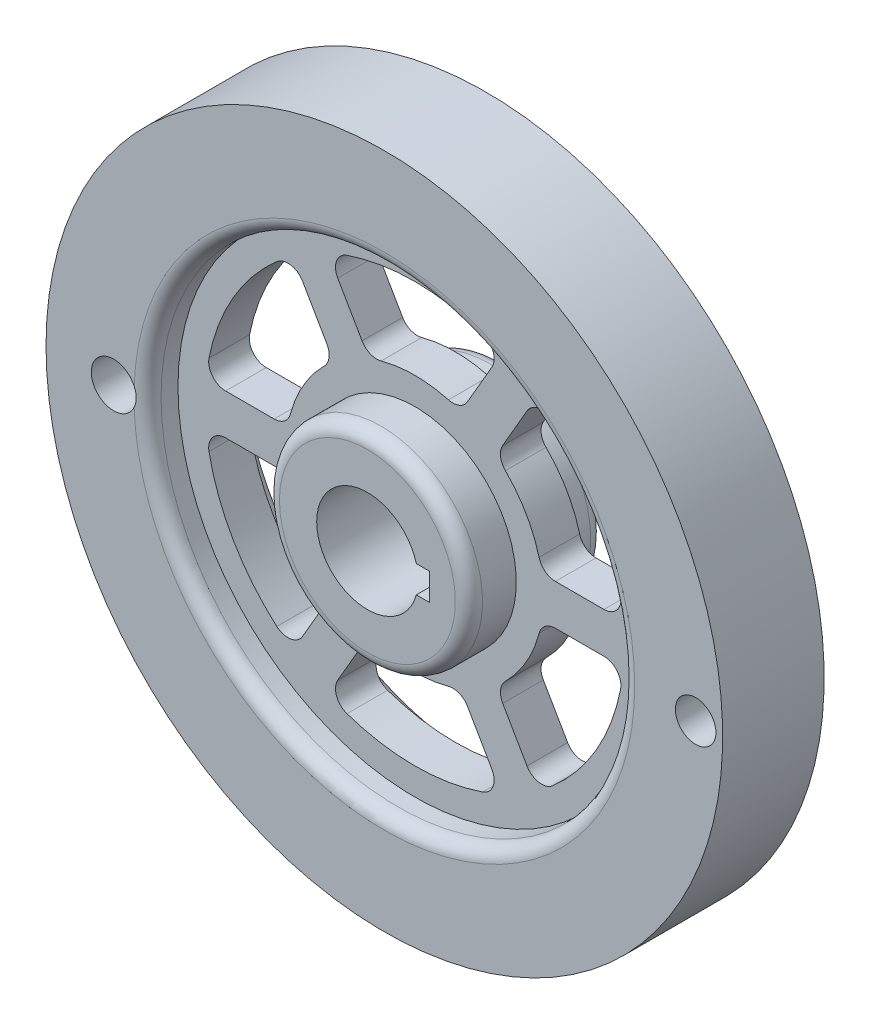
from build123d import *

# Parameters (mm, degrees)
FILLET_1_R               = 4
CUT_EXTRUDE_10_DEPTH     = 201
PATTERN_CIRCULAR_1_COUNT = 6
FILLET_2_R               = 5
SKETCH_10_W              = 6.3
SKETCH_10_H              = 8
CUT_EXTRUDE_13_DEPTH     = 201
SKETCH_11_R              = 6.62185
CUT_EXTRUDE_14_DEPTH     = 201
SKETCH_12_R              = 6
CUT_EXTRUDE_15_DEPTH     = 201


with BuildPart() as part:
    # 草图1 → 旋转1 (revolve)
    with BuildSketch(Plane(origin=(0, 0, 0), x_dir=(1, 0, 0), z_dir=(0, 1, 0))):
        Polygon((15, 20), (30, 20), (30, 6), (70, 6), (70, 15), (100, 15), (100, -15), (70, -15), (70, -6), (30, -6), (30, -20), (15, -20), align=None)
    revolve(axis=Axis((0, 0, -20), (0, 0, 1)))

    # 圆角1
    fillet_1_edges = [part.edges().sort_by_distance(p)[0] for p in [
        (-70, 0, -15),
        (-70, 0, 15),
        (-30, 0, -20),
        (-30, 0, 20),
    ]]
    fillet(fillet_1_edges, radius=FILLET_1_R)

    # 草图8 → 切除-拉伸10 (cut, symmetric)
    with BuildSketch(Plane.XY):
        with BuildLine():
            Line((37.5233, 6), (61.709, 6))
            ThreePointArc((61.709, 6), (53.693260927, 30.999195997), (36.0505, 50.44))
            Line((36.0505, 50.44), (23.9577, 29.4952))
            ThreePointArc((23.9577, 29.4952), (32.908424465, 18.999310823), (37.5233, 6))
        make_face()
    cut_extrude_10 = extrude(amount=CUT_EXTRUDE_10_DEPTH, both=True, mode=Mode.SUBTRACT)

    # 阵列(圆周)1: 切除-拉伸10 ×6 about axis
    pattern_circular_1_axis = Axis((0, 0, 22), (0, 0, -1))
    for i in range(1, PATTERN_CIRCULAR_1_COUNT):
        add(cut_extrude_10.rotate(pattern_circular_1_axis, i * 360 / PATTERN_CIRCULAR_1_COUNT), mode=Mode.SUBTRACT)

    # 圆角2
    fillet_2_edges = [part.edges().sort_by_distance(p)[0] for p in [
        (37.52244249, -6.000376816, 0),
        (61.707571367, -6.000648819, 0),
        (36.050652423, -50.441561642, 0),
        (23.957802423, -29.496131034, 0),
        (13.56474249, -35.495576816, 0),
        (25.657071367, -56.440648819, 0),
        (-25.658347577, -56.441561642, 0),
        (-13.565497577, -35.496131034, 0),
        (-23.9577, -29.4952, 0),
        (-36.0505, -50.44, 0),
        (-61.709, -6, 0),
        (-37.5233, -6, 0),
        (-37.52244249, 6.000376816, 0),
        (-61.707571367, 6.000648819, 0),
        (-36.050652423, 50.441561642, 0),
        (-23.957802423, 29.496131034, 0),
        (-13.56474249, 35.495576816, 0),
        (-25.657071367, 56.440648819, 0),
        (25.658347577, 56.441561642, 0),
        (13.565497577, 35.496131034, 0),
        (23.9577, 29.4952, 0),
        (36.0505, 50.44, 0),
        (61.709, 6, 0),
        (37.5233, 6, 0),
    ]]
    fillet(fillet_2_edges, radius=FILLET_2_R)

    # 草图10 → 切除-拉伸13 (cut, symmetric)
    with BuildSketch(Plane.XY):
        with Locations((15.15, 0)):
            Rectangle(SKETCH_10_W, SKETCH_10_H)
    extrude(amount=CUT_EXTRUDE_13_DEPTH, both=True, mode=Mode.SUBTRACT)

    # 草图11 → 切除-拉伸14 (cut, symmetric)
    with BuildSketch(Plane.XY):
        with Locations((-80, 0)):
            Circle(SKETCH_11_R)
    extrude(amount=CUT_EXTRUDE_14_DEPTH, both=True, mode=Mode.SUBTRACT)

    # 草图12 → 切除-拉伸15 (cut, symmetric)
    with BuildSketch(Plane.XY):
        with Locations((92, 0)):
            Circle(SKETCH_12_R)
    extrude(amount=CUT_EXTRUDE_15_DEPTH, both=True, mode=Mode.SUBTRACT)


solid = part.part
